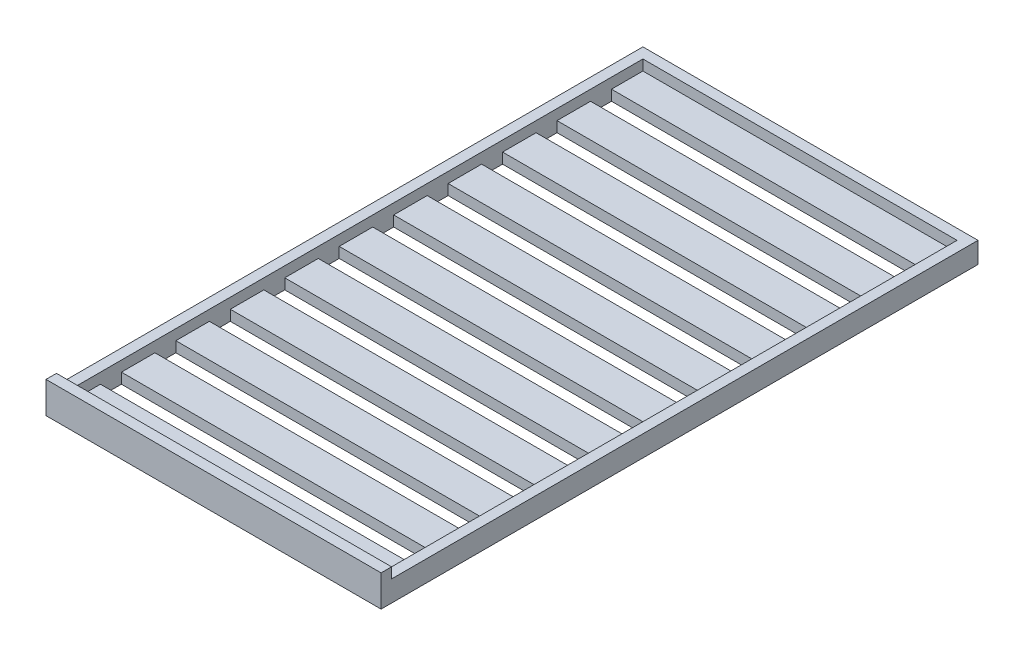
from build123d import *

# Parameters (mm, degrees)
TRAY_W              = 160
TRAY_H              = 285
BOSS_EXTRUDE1_DEPTH = 5
BOSS_EXTRUDE2_DEPTH = 5
SKETCH3_W           = 160
SKETCH3_H           = 5
BOSS_EXTRUDE3_DEPTH = 10
SKETCH4_W           = 150
SKETCH4_H           = 10
CUT_EXTRUDE1_DEPTH  = 171.293863659


with BuildPart() as part:
    # Tray → Boss-Extrude1 (new body)
    with BuildSketch(Plane(origin=(0, 0, 0), x_dir=(1, 0, 0), z_dir=(0, 1, 0))):
        with Locations((0, -7.5)):
            Rectangle(TRAY_W, TRAY_H)
    extrude(amount=BOSS_EXTRUDE1_DEPTH)

    # tray frame → Boss-Extrude2 (add)
    with BuildSketch(Plane(origin=(0, 5, 0), x_dir=(1, 0, 0), z_dir=(0, 1, 0))):
        Polygon((-80, -145), (-75, -145), (-75, 130), (75, 130), (75, -145), (80, -145), (80, 135), (-80, 135), align=None)
    extrude(amount=BOSS_EXTRUDE2_DEPTH)

    # Sketch3 → Boss-Extrude3 (add)
    with BuildSketch(Plane(origin=(0, 5, 0), x_dir=(1, 0, 0), z_dir=(0, 1, 0))):
        with Locations((0, -147.5)):
            Rectangle(SKETCH3_W, SKETCH3_H)
    extrude(amount=BOSS_EXTRUDE3_DEPTH)

    # Sketch4 → Cut-Extrude1 (cut, through all)
    with BuildSketch(Plane(origin=(0, 5, 0), x_dir=(1, 0, 0), z_dir=(0, 1, 0))):
        with Locations((0, 110)):
            Rectangle(SKETCH4_W, SKETCH4_H)
        with Locations((0, 84)):
            Rectangle(SKETCH4_W, SKETCH4_H)
        with Locations((0, 32)):
            Rectangle(SKETCH4_W, SKETCH4_H)
        with Locations((0, 6)):
            Rectangle(SKETCH4_W, SKETCH4_H)
        with Locations((0, -20)):
            Rectangle(SKETCH4_W, SKETCH4_H)
        with Locations((0, -46)):
            Rectangle(SKETCH4_W, SKETCH4_H)
        with Locations((0, -72)):
            Rectangle(SKETCH4_W, SKETCH4_H)
        with Locations((0, -98)):
            Rectangle(SKETCH4_W, SKETCH4_H)
        with Locations((0, -124)):
            Rectangle(SKETCH4_W, SKETCH4_H)
        with Locations((0, 58)):
            Rectangle(SKETCH4_W, SKETCH4_H)
    extrude(amount=-CUT_EXTRUDE1_DEPTH, mode=Mode.SUBTRACT)


solid = part.part
